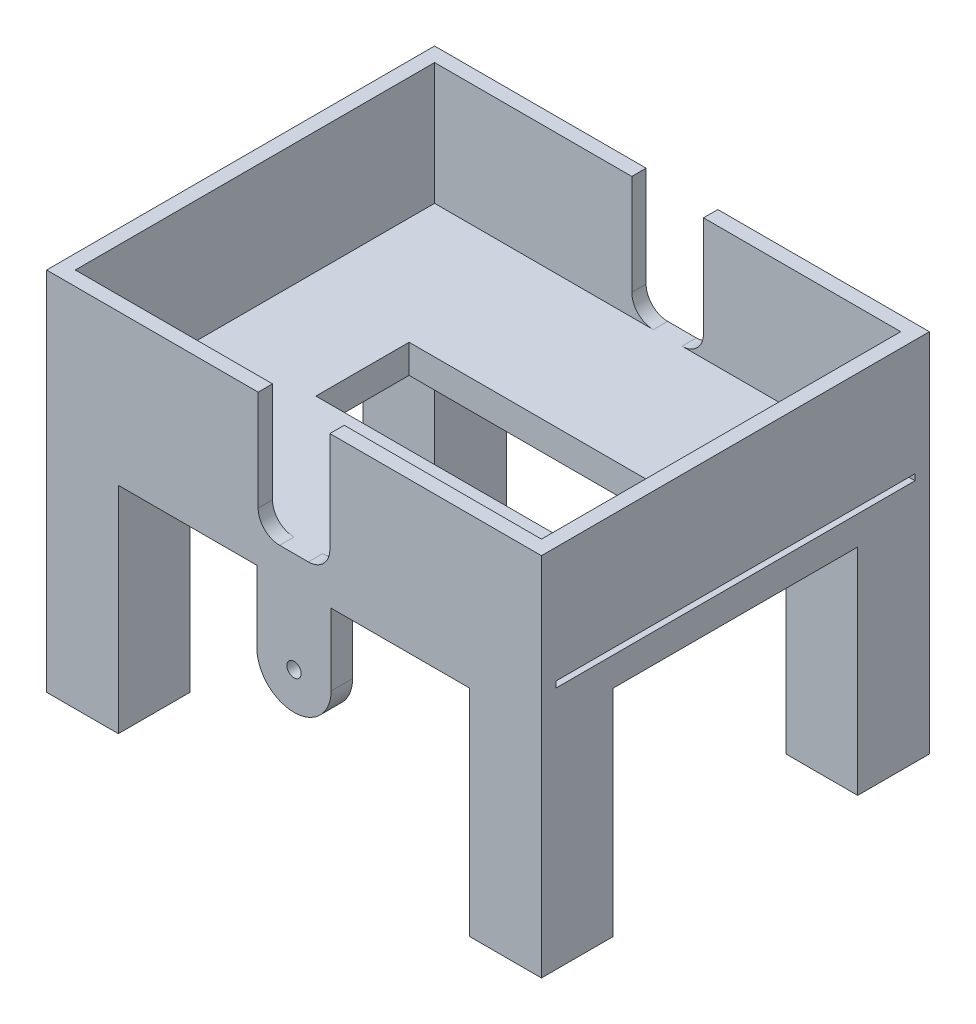
from build123d import *

# Parameters (mm, degrees)
SKETCH5_W               = 175.26
SKETCH5_H               = 137.414
SKETCH5_W_2             = 165.1
SKETCH5_H_2             = 127.254
BOSS_EXTRUDE2_DEPTH     = 43.18
SKETCH7_W               = 175.26
SKETCH7_H               = 137.414
BOSS_EXTRUDE4_DEPTH     = 10.16
SKETCH9_W               = 127.254
SKETCH9_H               = 2.159
CUT_EXTRUDE1_DEPTH      = 8.128
CUT_EXTRUDE2_DEPTH      = 13.208
CUT_EXTRUDE2_DEPTH_BACK = 147.066
SKETCH11_W              = 88.9
SKETCH11_H              = 33.02
CUT_EXTRUDE3_DEPTH      = 10.16
SKETCH12_W              = 25.4
SKETCH12_H              = 25.4
BOSS_EXTRUDE5_DEPTH     = 76.2
SKETCH13_W              = 20.32
SKETCH13_H              = 20.32
CUT_EXTRUDE4_DEPTH      = 76.2
SKETCH14_R              = 2.54
BOSS_EXTRUDE6_DEPTH     = 7.62
SKETCH15_R              = 2.54
BOSS_EXTRUDE7_DEPTH     = 25.4


with BuildPart() as part:
    # Sketch5 → Boss-Extrude2 (new body)
    with BuildSketch(Plane(origin=(0, 0, 0), x_dir=(1, 0, 0), z_dir=(0, 1, 0))):
        with Locations((82.55, 63.627)):
            Rectangle(SKETCH5_W, SKETCH5_H)
        with Locations((82.55, 63.627)):
            Rectangle(SKETCH5_W_2, SKETCH5_H_2, mode=Mode.SUBTRACT)
    extrude(amount=BOSS_EXTRUDE2_DEPTH)

    # Sketch7 → Boss-Extrude4 (add)
    with BuildSketch(Plane(origin=(0, 0, 0), x_dir=(1, 0, 0), z_dir=(0, 1, 0))):
        with Locations((82.55, 63.627)):
            Rectangle(SKETCH7_W, SKETCH7_H)
    extrude(amount=-BOSS_EXTRUDE4_DEPTH)

    # Sketch9 → Cut-Extrude1 (cut)
    with BuildSketch(Plane(origin=(170.18, 0, 0), x_dir=(0, 0, -1), z_dir=(1, 0, 0))):
        with Locations((63.627, 1.0795)):
            Rectangle(SKETCH9_W, SKETCH9_H)
    extrude(amount=-CUT_EXTRUDE1_DEPTH, mode=Mode.SUBTRACT)

    # Sketch10 → Cut-Extrude2 (cut, two sides: drawn at the far end of the back side and taken through both)
    with BuildSketch(Plane.XY.offset(5.08).offset(-CUT_EXTRUDE2_DEPTH_BACK)):
        with BuildLine():
            Line((69.85, 43.18), (95.25, 43.18))
            Line((95.25, 43.18), (95.25, 7.62))
            ThreePointArc((95.25, 7.62), (93.018153673, 2.231846327), (87.63, 0))
            Line((87.63, 0), (77.47, 0))
            ThreePointArc((77.47, 0), (72.081846327, 2.231846327), (69.85, 7.62))
            Line((69.85, 7.62), (69.85, 43.18))
        make_face()
    extrude(amount=CUT_EXTRUDE2_DEPTH + CUT_EXTRUDE2_DEPTH_BACK, mode=Mode.SUBTRACT)

    # Sketch11 → Cut-Extrude3 (cut)
    with BuildSketch(Plane.XZ.offset(10.16)):
        with Locations((82.55, -63.627)):
            Rectangle(SKETCH11_W, SKETCH11_H)
    extrude(amount=-CUT_EXTRUDE3_DEPTH, mode=Mode.SUBTRACT)

    # Sketch12 → Boss-Extrude5 (add)
    with BuildSketch(Plane.XZ.offset(10.16)):
        with Locations((7.62, -7.62)):
            Rectangle(SKETCH12_W, SKETCH12_H)
        with Locations((157.48, -7.62)):
            Rectangle(SKETCH12_W, SKETCH12_H)
        with Locations((157.48, -119.634)):
            Rectangle(SKETCH12_W, SKETCH12_H)
        with Locations((7.62, -119.634)):
            Rectangle(SKETCH12_W, SKETCH12_H)
    extrude(amount=BOSS_EXTRUDE5_DEPTH)

    # Sketch13 → Cut-Extrude4 (cut)
    with BuildSketch(Plane.XZ.offset(86.36)):
        with Locations((7.62, -7.62)):
            Rectangle(SKETCH13_W, SKETCH13_H)
        with Locations((157.48, -7.62)):
            Rectangle(SKETCH13_W, SKETCH13_H)
        with Locations((157.48, -119.634)):
            Rectangle(SKETCH13_W, SKETCH13_H)
        with Locations((7.62, -119.634)):
            Rectangle(SKETCH13_W, SKETCH13_H)
    extrude(amount=-CUT_EXTRUDE4_DEPTH, mode=Mode.SUBTRACT)

    # Sketch14 → Boss-Extrude6 (add)
    with BuildSketch(Plane.XY.offset(5.08)):
        with BuildLine():
            Line((69.409163099, -10.16), (69.409163099, -35.56))
            ThreePointArc((69.409163099, -35.56), (82.55, -48.700836901), (95.690836901, -35.56))
            Line((95.690836901, -35.56), (95.690836901, -10.16))
            Line((95.690836901, -10.16), (69.409163099, -10.16))
        make_face()
        with Locations((82.55, -35.56)):
            Circle(SKETCH14_R, mode=Mode.SUBTRACT)
    boss_extrude6 = extrude(amount=-BOSS_EXTRUDE6_DEPTH)

    # Mirror2: Boss-Extrude6 across plane
    add(boss_extrude6.mirror(Plane.XY.offset(-63.627)))

    # Sketch15 → Boss-Extrude7 (add)
    with BuildSketch(Plane(origin=(0, 0, -132.334), x_dir=(-1, 0, 0), z_dir=(0, 0, -1))):
        with Locations(Location((-122.428, 13.97, 0), (0, 0, 180))):
            Circle(SKETCH15_R)
    extrude(amount=BOSS_EXTRUDE7_DEPTH)


solid = part.part
